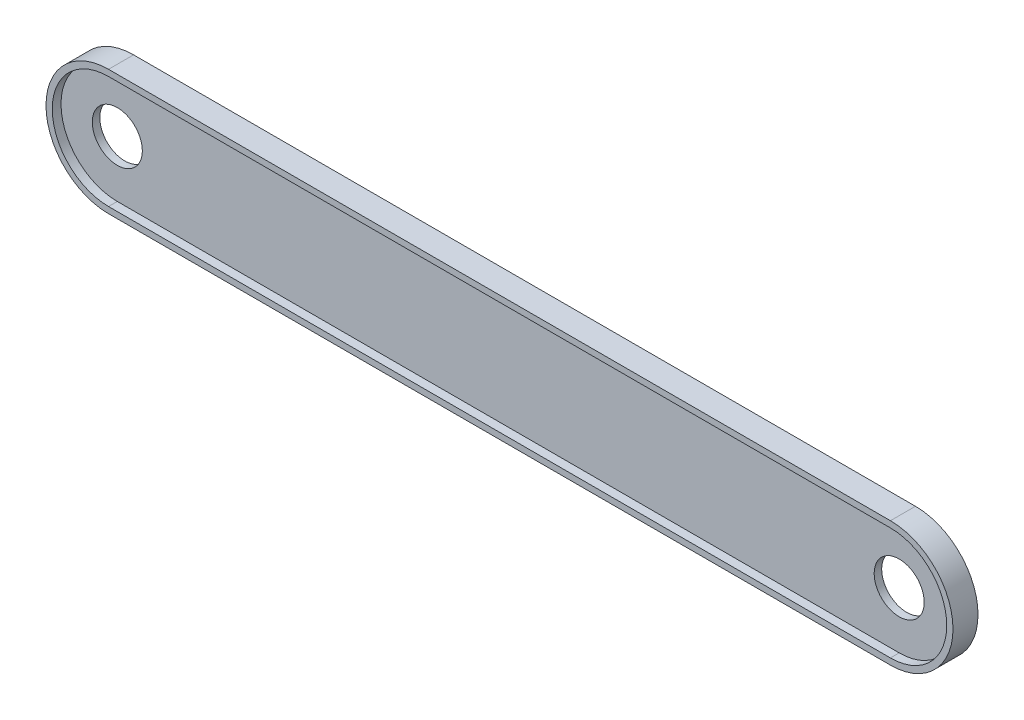
from build123d import *

# Parameters (mm, degrees)
SKETCH1_R           = 20
BOSS_EXTRUDE1_DEPTH = 10
CUT_EXTRUDE1_DEPTH  = 7


with BuildPart() as part:
    # Sketch1 → Boss-Extrude1 (new, symmetric)
    with BuildSketch(Plane.XY):
        with BuildLine():
            Line((-312.5, -50), (312.5, -50))
            ThreePointArc((312.5, -50), (362.5, 0), (312.5, 50))
            Line((312.5, 50), (-312.5, 50))
            ThreePointArc((-312.5, 50), (-362.5, 0), (-312.5, -50))
        make_face()
        with Locations((312.5, 0)):
            Circle(SKETCH1_R, mode=Mode.SUBTRACT)
        with Locations((-312.5, 0)):
            Circle(SKETCH1_R, mode=Mode.SUBTRACT)
    extrude(amount=BOSS_EXTRUDE1_DEPTH, both=True)

    # Sketch2 → Cut-Extrude1 (cut)
    with BuildSketch(Plane(origin=(0, 0, -10), x_dir=(-1, 0, 0), z_dir=(0, 0, -1))):
        with BuildLine():
            Line((312.5, 45), (-312.5, 45))
            ThreePointArc((-312.5, 45), (-357.5, 0), (-312.5, -45))
            Line((-312.5, -45), (312.5, -45))
            ThreePointArc((312.5, -45), (357.5, 0), (312.5, 45))
        make_face()
    cut_extrude1 = extrude(amount=-CUT_EXTRUDE1_DEPTH, mode=Mode.SUBTRACT)

    # Mirror2: Cut-Extrude1 across plane
    add(cut_extrude1.mirror(Plane.XY), mode=Mode.SUBTRACT)


solid = part.part
